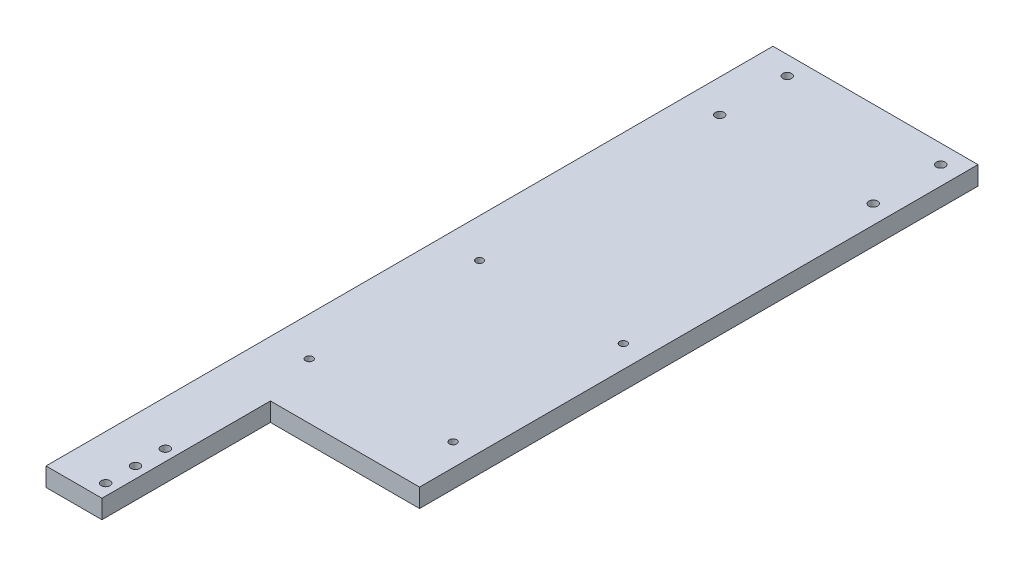
from build123d import *

# Parameters (mm, degrees)
SKETCH1_W           = 69.85
SKETCH1_H           = 247.65
BOSS_EXTRUDE1_DEPTH = 6.35
SKETCH2_W           = 50.8
SKETCH2_H           = 57.404
CUT_EXTRUDE1_DEPTH  = 258.390496134
SKETCH3_R           = 1.5
CUT_EXTRUDE2_DEPTH  = 258.390496134
SKETCH4_R           = 1.5
CUT_EXTRUDE3_DEPTH  = 258.390496134
SKETCH5_R           = 1.25
CUT_EXTRUDE4_DEPTH  = 258.390496134


with BuildPart() as part:
    # Sketch1 → Boss-Extrude1 (new body)
    with BuildSketch(Plane(origin=(0, 0, 0), x_dir=(1, 0, 0), z_dir=(0, 1, 0))):
        with Locations((34.925, 123.825)):
            Rectangle(SKETCH1_W, SKETCH1_H)
    extrude(amount=BOSS_EXTRUDE1_DEPTH)

    # Sketch2 → Cut-Extrude1 (cut, through all)
    with BuildSketch(Plane(origin=(0, 6.35, 0), x_dir=(1, 0, 0), z_dir=(0, 1, 0))):
        with Locations((44.45, 28.702)):
            Rectangle(SKETCH2_W, SKETCH2_H)
    extrude(amount=-CUT_EXTRUDE1_DEPTH, mode=Mode.SUBTRACT)

    # Sketch3 → Cut-Extrude2 (cut, through all)
    with BuildSketch(Plane(origin=(0, 6.35, 0), x_dir=(1, 0, 0), z_dir=(0, 1, 0))):
        with Locations(Location((15.24, 5.08, 0), (0, 0, 270))):
            Circle(SKETCH3_R)
        with Locations(Location((15.24, 25.4, 0), (0, 0, 270))):
            Circle(SKETCH3_R)
        with Locations(Location((15.24, 15.24, 0), (0, 0, 270))):
            Circle(SKETCH3_R)
    extrude(amount=-CUT_EXTRUDE2_DEPTH, mode=Mode.SUBTRACT)

    # Sketch4 → Cut-Extrude3 (cut, through all)
    with BuildSketch(Plane(origin=(0, 6.35, 0), x_dir=(1, 0, 0), z_dir=(0, 1, 0))):
        with Locations(Location((63.5, 241.3, 0), (0, 0, 270))):
            Circle(SKETCH4_R)
        with Locations(Location((63.5, 218.3, 0), (0, 0, 270))):
            Circle(SKETCH4_R)
        with Locations(Location((11.2, 218.3, 0), (0, 0, 270))):
            Circle(SKETCH4_R)
        with Locations(Location((11.2, 241.3, 0), (0, 0, 270))):
            Circle(SKETCH4_R)
    extrude(amount=-CUT_EXTRUDE3_DEPTH, mode=Mode.SUBTRACT)

    # Sketch5 → Cut-Extrude4 (cut, through all)
    with BuildSketch(Plane(origin=(0, 6.35, 0), x_dir=(1, 0, 0), z_dir=(0, 1, 0))):
        with Locations(Location((13.23, 134.454, 0), (0, 0, 270))):
            Circle(SKETCH5_R)
        with Locations(Location((62.23, 134.454, 0), (0, 0, 270))):
            Circle(SKETCH5_R)
        with Locations(Location((62.23, 76.454, 0), (0, 0, 270))):
            Circle(SKETCH5_R)
        with Locations(Location((13.23, 76.454, 0), (0, 0, 270))):
            Circle(SKETCH5_R)
    extrude(amount=-CUT_EXTRUDE4_DEPTH, mode=Mode.SUBTRACT)


solid = part.part
